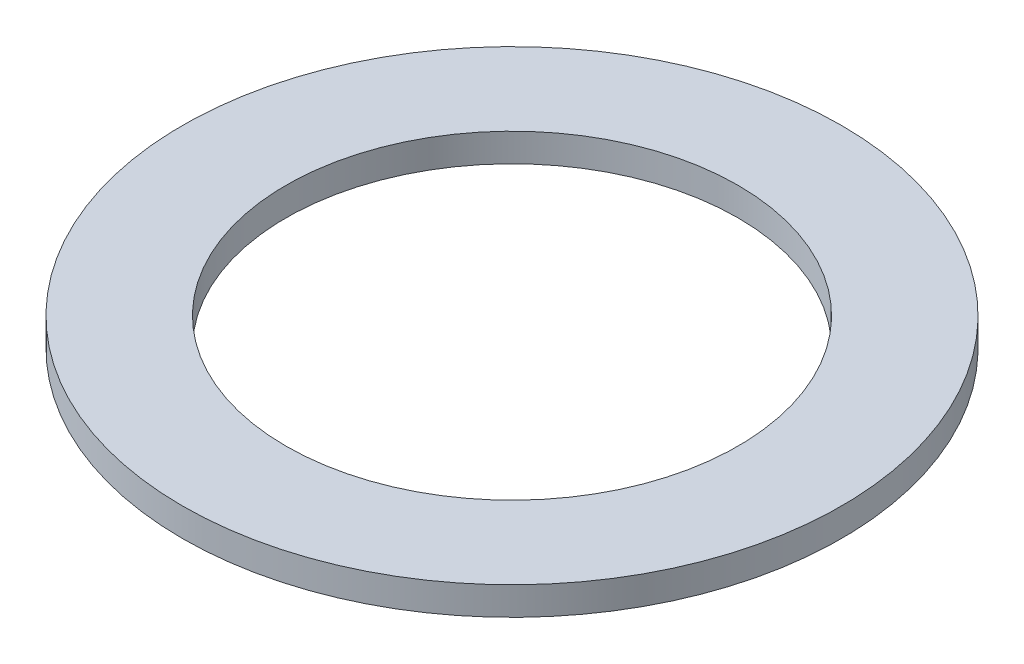
from build123d import *

# Parameters (mm, degrees)
SZKIC1_R                    = 17.5
SZKIC1_R_2                  = 12
DODANIE_WYCI_GNI_CIE1_DEPTH = 1.5


with BuildPart() as part:
    # Szkic1 → Dodanie-wyciągnięcie1 (new body)
    with BuildSketch(Plane(origin=(0, 0, 0), x_dir=(1, 0, 0), z_dir=(0, 1, 0))):
        with Locations(Location((0, 0, 0), (0, 0, 270))):
            Circle(SZKIC1_R)
        with Locations(Location((0, 0, 0), (0, 0, 270))):
            Circle(SZKIC1_R_2, mode=Mode.SUBTRACT)
    extrude(amount=DODANIE_WYCI_GNI_CIE1_DEPTH)


solid = part.part
